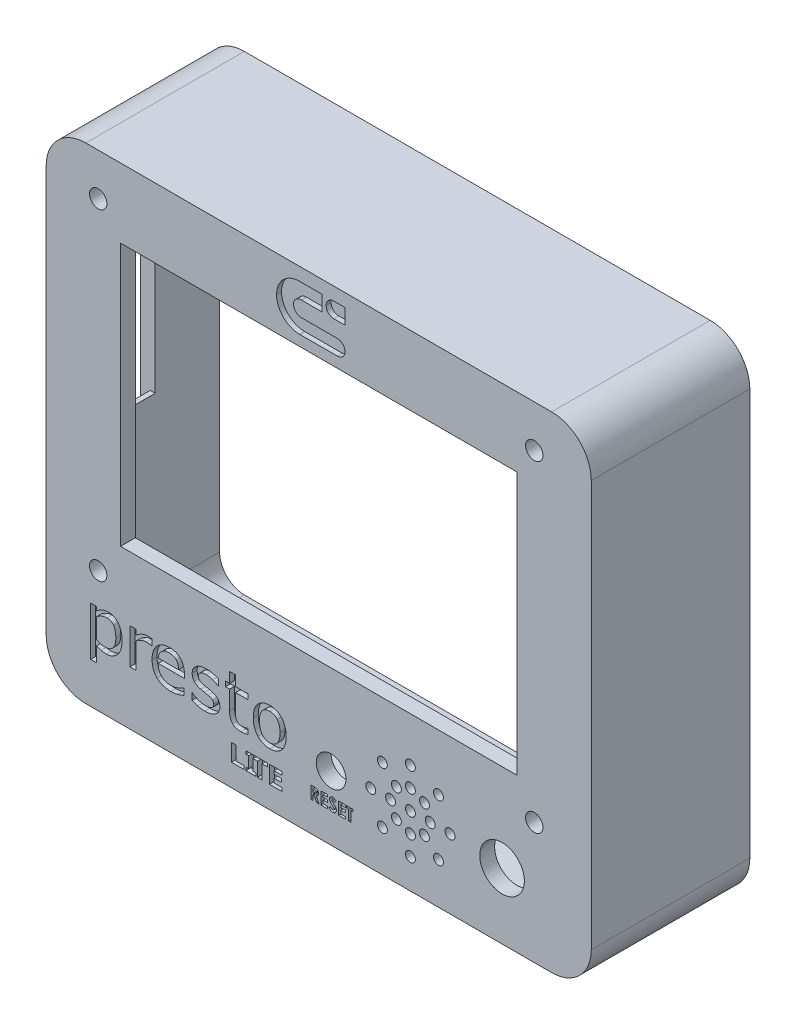
from build123d import *

# Parameters (mm, degrees)
ESBO_O1_W                = 110
ESBO_O1_H                = 98
RESSALTO_EXTRUS_O1_DEPTH = 22
FILETE1_R                = 8
CASCA1_T                 = -3
ESBO_O2_R                = 4.5
ESBO_O2_R_2              = 3
ESBO_O2_R_3              = 1.75
ESBO_O2_W                = 80
ESBO_O2_H                = 53
CORTE_EXTRUS_O1_DEPTH    = 77.876524375
ESBO_O3_R                = 1
CORTE_EXTRUS_O2_DEPTH    = 10
ESBO_O5_W                = 6
ESBO_O5_H                = 30
CORTE_EXTRUS_O3_DEPTH    = 4
CHANFRO1_SIZE            = 2
CORTE_EXTRUS_O4_DEPTH    = 1
CORTE_EXTRUS_O5_DEPTH    = 1
CORTE_EXTRUS_O6_DEPTH    = 1
RESSALTO_EXTRUS_O2_DEPTH = 10


with BuildPart() as part:
    # Esboço1 → Ressalto-extrusão1 (new body)
    with BuildSketch(Plane.XY):
        Rectangle(ESBO_O1_W, ESBO_O1_H)
    extrude(amount=RESSALTO_EXTRUS_O1_DEPTH)

    # Filete1
    filete1_edges = [part.edges().sort_by_distance(p)[0] for p in [
        (55, 49, 11),
        (55, -49, 11),
        (-55, -49, 11),
        (-55, 49, 11),
    ]]
    fillet(filete1_edges, radius=FILETE1_R)

    # Casca1
    casca1_openings = [part.faces().sort_by_distance(p)[0] for p in [
        (0, 0, 0),
    ]]
    offset(amount=CASCA1_T, openings=casca1_openings, kind=Kind.INTERSECTION)

    # Esboço2 → Corte-extrusão1 (cut, through all)
    with BuildSketch(Plane.XY.offset(22)):
        with Locations((37, -35.75)):
            Circle(ESBO_O2_R)
        with Locations((2.5, -36)):
            Circle(ESBO_O2_R_2)
        with Locations((-44.5, 40.5)):
            Circle(ESBO_O2_R_3)
        with Locations((43.5, 40.5)):
            Circle(ESBO_O2_R_3)
        with Locations((43.5, -24.5)):
            Circle(ESBO_O2_R_3)
        with Locations((-44.5, -24.5)):
            Circle(ESBO_O2_R_3)
        with Locations((0, 8.5)):
            Rectangle(ESBO_O2_W, ESBO_O2_H)
    extrude(amount=-CORTE_EXTRUS_O1_DEPTH, mode=Mode.SUBTRACT)

    # Esboço3 → Corte-extrusão2 (cut)
    with BuildSketch(Plane.XY.offset(22)):
        with Locations((18.5, -35)):
            Circle(ESBO_O3_R)
        with Locations((18.5, -27)):
            Circle(ESBO_O3_R)
        with Locations((26.5, -35)):
            Circle(ESBO_O3_R)
        with Locations((18.5, -43)):
            Circle(ESBO_O3_R)
        with Locations((10.5, -35)):
            Circle(ESBO_O3_R)
        with Locations((12.843145751, -29.343145751)):
            Circle(ESBO_O3_R)
        with Locations((24.156854249, -29.343145751)):
            Circle(ESBO_O3_R)
        with Locations((24.156854249, -40.656854249)):
            Circle(ESBO_O3_R)
        with Locations((12.843145751, -40.656854249)):
            Circle(ESBO_O3_R)
        with Locations((18.5, -31)):
            Circle(ESBO_O3_R)
        with Locations((21.328427125, -32.171572875)):
            Circle(ESBO_O3_R)
        with Locations((22.5, -35)):
            Circle(ESBO_O3_R)
        with Locations((21.328427125, -37.828427125)):
            Circle(ESBO_O3_R)
        with Locations((18.5, -39)):
            Circle(ESBO_O3_R)
        with Locations((15.671572875, -37.828427125)):
            Circle(ESBO_O3_R)
        with Locations((14.5, -35)):
            Circle(ESBO_O3_R)
        with Locations((15.671572875, -32.171572875)):
            Circle(ESBO_O3_R)
    extrude(amount=-CORTE_EXTRUS_O2_DEPTH, mode=Mode.SUBTRACT)

    # Esboço5 → Corte-extrusão3 (cut)
    with BuildSketch(Plane.ZY.offset(55)):
        with Locations((6, 8.25)):
            Rectangle(ESBO_O5_W, ESBO_O5_H)
    extrude(amount=-CORTE_EXTRUS_O3_DEPTH, mode=Mode.SUBTRACT)

    # Chanfro1
    chanfro1_edges = [part.edges().sort_by_distance(p)[0] for p in [
        (-55, 8.25, 9),
        (-55, 23.25, 6),
        (-55, -6.75, 6),
    ]]
    chamfer(chanfro1_edges, length=CHANFRO1_SIZE)

    # Esboço6 → Corte-extrusão4 (cut)
    with BuildSketch(Plane.XY.offset(22)):
        with BuildLine():
            Line((3.769042455, 40.21678814), (0.490728105, 40.21678814))
            Line((0.490728105, 40.21678814), (-3.553968015, 40.21678814))
            Line((-3.553968015, 40.21678814), (-3.553968015, 40.22878964))
            add(Edge.make_bspline(
                [(-3.553968015, 40.22878964), (-4.400740395, 40.2331712), (-5.085969075, 40.92059039), (-5.085969075, 41.76850595)],
                knots=[0, 0, 0, 0, 1, 1, 1, 1], degree=3))
            add(Edge.make_bspline(
                [(-5.085969075, 41.76850595), (-5.085969075, 42.6190883), (-4.396454145, 43.30869854), (-3.545776485, 43.30869854)],
                knots=[0, 0, 0, 0, 1, 1, 1, 1], degree=3))
            add(Edge.make_bspline(
                [(-3.545776485, 43.30869854), (-3.506723955, 43.30869854), (-3.468433635, 43.30565051), (-3.430047735, 43.30279283)],
                knots=[0, 0, 0, 0, 1, 1, 1, 1], degree=3))
            Line((-3.430047735, 43.30279283), (0.489775545, 43.30279283))
            Line((0.489775545, 43.30279283), (0.627030855, 43.30279283))
            Line((0.627030855, 43.30279283), (0.627030855, 46.38908345))
            Line((0.627030855, 46.38908345), (-3.570827355, 46.38908345))
            Line((-3.570827355, 46.38908345), (-3.570827355, 46.37803451))
            add(Edge.make_bspline(
                [(-3.570827355, 46.37803451), (-3.671792235, 46.38460658), (-3.773424015, 46.38908345), (-3.876103395, 46.38908345)],
                knots=[0, 0, 0, 0, 1, 1, 1, 1], degree=3))
            add(Edge.make_bspline(
                [(-3.876103395, 46.38908345), (-6.433470765, 46.38908345), (-8.506586925, 44.31577667), (-8.506586925, 41.75850461)],
                knots=[0, 0, 0, 0, 1, 1, 1, 1], degree=3))
            add(Edge.make_bspline(
                [(-8.506586925, 41.75850461), (-8.506586925, 39.2010422), (-6.433470765, 37.12792604), (-3.876103395, 37.12792604)],
                knots=[0, 0, 0, 0, 1, 1, 1, 1], degree=3))
            add(Edge.make_bspline(
                [(-3.876103395, 37.12792604), (-3.840194205, 37.12792604), (-3.804761295, 37.12983089), (-3.769042455, 37.13059283)],
                knots=[0, 0, 0, 0, 1, 1, 1, 1], degree=3))
            Line((-3.769042455, 37.13059283), (3.769042455, 37.13059283))
            add(Edge.make_bspline(
                [(3.769042455, 37.13059283), (4.621339575, 37.13059283), (5.312187765, 37.82144129), (5.312187765, 38.67383345)],
                knots=[0, 0, 0, 0, 1, 1, 1, 1], degree=3))
            add(Edge.make_bspline(
                [(5.312187765, 38.67383345), (5.312187765, 39.52593995), (4.621339575, 40.21678814), (3.769042455, 40.21678814)],
                knots=[0, 0, 0, 0, 1, 1, 1, 1], degree=3))
        make_face()
        with BuildLine():
            Line((3.032369595, 43.3028309), (5.284651005, 43.3028309))
            Line((5.284651005, 43.3028309), (5.284651005, 46.38912152))
            Line((5.284651005, 46.38912152), (3.032369595, 46.38912152))
            add(Edge.make_bspline(
                [(3.032369595, 46.38912152), (2.180167785, 46.38912152), (1.489319595, 45.69808271), (1.489319595, 44.84597621)],
                knots=[0, 0, 0, 0, 1, 1, 1, 1], degree=3))
            add(Edge.make_bspline(
                [(1.489319595, 44.84597621), (1.489319595, 43.99367936), (2.180167785, 43.3028309), (3.032369595, 43.3028309)],
                knots=[0, 0, 0, 0, 1, 1, 1, 1], degree=3))
        make_face()
    extrude(amount=-CORTE_EXTRUS_O4_DEPTH, mode=Mode.SUBTRACT)

    # Esboço7 → Corte-extrusão5 (cut)
    # profile 1 of 9: a face of its own
    with BuildSketch(Plane.XY.offset(22)):
        with BuildLine():
            Line((-44.812726377, -37.755554289), (-44.812726377, -40.769705489))
            Line((-44.812726377, -40.769705489), (-46.023538777, -40.769705489))
            Line((-46.023538777, -40.769705489), (-46.023538777, -30.922188689))
            Line((-46.023538777, -30.922188689), (-44.812726377, -30.922188689))
            Line((-44.812726377, -30.922188689), (-44.812726377, -31.675726689))
            add(Edge.make_bspline(
                [(-44.812726377, -31.675726689), (-44.490701177, -31.405225489), (-44.130033177, -31.179807889), (-43.730722377, -30.999474689)],
                knots=[0, 0, 0, 0, 1, 1, 1, 1], degree=3))
            add(Edge.make_bspline(
                [(-43.730722377, -30.999474689), (-43.327118377, -30.814847489), (-42.897752377, -30.722533489), (-42.442623977, -30.722533489)],
                knots=[0, 0, 0, 0, 1, 1, 1, 1], degree=3))
            add(Edge.make_bspline(
                [(-42.442623977, -30.722533489), (-41.575303977, -30.722533489), (-40.901198777, -31.050998289), (-40.420307577, -31.707928289)],
                knots=[0, 0, 0, 0, 1, 1, 1, 1], degree=3))
            add(Edge.make_bspline(
                [(-40.420307577, -31.707928289), (-39.935123977, -32.360565089), (-39.692532377, -33.268675489), (-39.692532377, -34.432258689)],
                knots=[0, 0, 0, 0, 1, 1, 1, 1], degree=3))
            add(Edge.make_bspline(
                [(-39.692532377, -34.432258689), (-39.692532377, -35.016197089), (-39.776258377, -35.550757889), (-39.943711177, -36.035941489)],
                knots=[0, 0, 0, 0, 1, 1, 1, 1], degree=3))
            add(Edge.make_bspline(
                [(-39.943711177, -36.035941489), (-40.111164377, -36.516831489), (-40.347315977, -36.924729489), (-40.652165577, -37.259635489)],
                knots=[0, 0, 0, 0, 1, 1, 1, 1], degree=3))
            add(Edge.make_bspline(
                [(-40.652165577, -37.259635489), (-40.935547577, -37.577366689), (-41.270453577, -37.824252289), (-41.656883577, -38.000292689)],
                knots=[0, 0, 0, 0, 1, 1, 1, 1], degree=3))
            add(Edge.make_bspline(
                [(-41.656883577, -38.000292689), (-42.039019177, -38.172039889), (-42.444770377, -38.257913089), (-42.874137577, -38.257913089)],
                knots=[0, 0, 0, 0, 1, 1, 1, 1], degree=3))
            add(Edge.make_bspline(
                [(-42.874137577, -38.257913089), (-43.247685977, -38.257913089), (-43.586885177, -38.217123089), (-43.891734777, -38.135542689)],
                knots=[0, 0, 0, 0, 1, 1, 1, 1], degree=3))
            add(Edge.make_bspline(
                [(-43.891734777, -38.135542689), (-44.192291577, -38.053963089), (-44.499288777, -37.927300289), (-44.812726377, -37.755554289)],
                knots=[0, 0, 0, 0, 1, 1, 1, 1], degree=3))
        make_face()
        with BuildLine():
            Line((-44.812726377, -32.693323889), (-44.812726377, -36.770158289))
            add(Edge.make_bspline(
                [(-44.812726377, -36.770158289), (-44.469233177, -36.924730289), (-44.175117177, -37.029925089), (-43.930377577, -37.085742689)],
                knots=[0, 0, 0, 0, 1, 1, 1, 1], degree=3))
            add(Edge.make_bspline(
                [(-43.930377577, -37.085742689), (-43.681345577, -37.141560289), (-43.400110777, -37.169469089), (-43.086673177, -37.169469089)],
                knots=[0, 0, 0, 0, 1, 1, 1, 1], degree=3))
            add(Edge.make_bspline(
                [(-43.086673177, -37.169469089), (-42.412567977, -37.169469089), (-41.886593977, -36.941905089), (-41.508751977, -36.486776689)],
                knots=[0, 0, 0, 0, 1, 1, 1, 1], degree=3))
            add(Edge.make_bspline(
                [(-41.508751977, -36.486776689), (-41.130909977, -36.031647889), (-40.941988777, -35.357542689), (-40.941988777, -34.464460289)],
                knots=[0, 0, 0, 0, 1, 1, 1, 1], degree=3))
            add(Edge.make_bspline(
                [(-40.941988777, -34.464460289), (-40.941988777, -33.597140289), (-41.090119977, -32.948797089), (-41.386382777, -32.519431089)],
                knots=[0, 0, 0, 0, 1, 1, 1, 1], degree=3))
            add(Edge.make_bspline(
                [(-41.386382777, -32.519431089), (-41.682645177, -32.090065089), (-42.137773177, -31.875381889), (-42.751766777, -31.875381889)],
                knots=[0, 0, 0, 0, 1, 1, 1, 1], degree=3))
            add(Edge.make_bspline(
                [(-42.751766777, -31.875381889), (-43.099554377, -31.875381889), (-43.449487977, -31.950520689), (-43.801567977, -32.100798689)],
                knots=[0, 0, 0, 0, 1, 1, 1, 1], degree=3))
            add(Edge.make_bspline(
                [(-43.801567977, -32.100798689), (-44.153648377, -32.251077089), (-44.490701177, -32.448585489), (-44.812726377, -32.693323889)],
                knots=[0, 0, 0, 0, 1, 1, 1, 1], degree=3))
        make_face(mode=Mode.SUBTRACT)
    # profile 2 of 9: a face of its own
    with BuildSketch(Plane.XY.offset(22)):
        with BuildLine():
            Line((-33.613767971, -32.242489889), (-33.678172371, -32.242489889))
            add(Edge.make_bspline(
                [(-33.678172371, -32.242489889), (-33.858506371, -32.199553089), (-34.034546771, -32.169497489), (-34.206293571, -32.152323089)],
                knots=[0, 0, 0, 0, 1, 1, 1, 1], degree=3))
            add(Edge.make_bspline(
                [(-34.206293571, -32.152323089), (-34.373746371, -32.130854689), (-34.573401571, -32.120120689), (-34.805259571, -32.120120689)],
                knots=[0, 0, 0, 0, 1, 1, 1, 1], degree=3))
            add(Edge.make_bspline(
                [(-34.805259571, -32.120120689), (-35.178808371, -32.120120689), (-35.539475571, -32.203847089), (-35.887262371, -32.371299489)],
                knots=[0, 0, 0, 0, 1, 1, 1, 1], degree=3))
            add(Edge.make_bspline(
                [(-35.887262371, -32.371299489), (-36.235048771, -32.534459489), (-36.569954771, -32.746995489), (-36.891980371, -33.008908289)],
                knots=[0, 0, 0, 0, 1, 1, 1, 1], degree=3))
            Line((-36.891980371, -33.008908289), (-36.891980371, -38.116221889))
            Line((-36.891980371, -38.116221889), (-38.102792771, -38.116221889))
            Line((-38.102792771, -38.116221889), (-38.102792771, -30.922188689))
            Line((-38.102792771, -30.922188689), (-36.891980371, -30.922188689))
            Line((-36.891980371, -30.922188689), (-36.891980371, -31.984870689))
            add(Edge.make_bspline(
                [(-36.891980371, -31.984870689), (-36.411089171, -31.598440689), (-35.988163171, -31.325793089), (-35.623201571, -31.166927489)],
                knots=[0, 0, 0, 0, 1, 1, 1, 1], degree=3))
            add(Edge.make_bspline(
                [(-35.623201571, -31.166927489), (-35.253946771, -31.003768289), (-34.878251171, -30.922188689), (-34.496115571, -30.922188689)],
                knots=[0, 0, 0, 0, 1, 1, 1, 1], degree=3))
            add(Edge.make_bspline(
                [(-34.496115571, -30.922188689), (-34.285725971, -30.922188689), (-34.133300771, -30.928629089), (-34.038839971, -30.941509889)],
                knots=[0, 0, 0, 0, 1, 1, 1, 1], degree=3))
            add(Edge.make_bspline(
                [(-34.038839971, -30.941509889), (-33.944379971, -30.950096689), (-33.802689171, -30.969418689), (-33.613767971, -30.999474689)],
                knots=[0, 0, 0, 0, 1, 1, 1, 1], degree=3))
            Line((-33.613767971, -30.999474689), (-33.613767971, -32.242489889))
        make_face()
    # profile 3 of 9: a face of its own
    with BuildSketch(Plane.XY.offset(22)):
        with BuildLine():
            Line((-27.095060371, -34.644794689), (-32.395587571, -34.644794689))
            add(Edge.make_bspline(
                [(-32.395587571, -34.644794689), (-32.395587571, -35.087042289), (-32.329035971, -35.473471889), (-32.195932371, -35.804083489)],
                knots=[0, 0, 0, 0, 1, 1, 1, 1], degree=3))
            add(Edge.make_bspline(
                [(-32.195932371, -35.804083489), (-32.062828771, -36.130402289), (-31.880347971, -36.398756689), (-31.648489971, -36.609146289)],
                knots=[0, 0, 0, 0, 1, 1, 1, 1], degree=3))
            add(Edge.make_bspline(
                [(-31.648489971, -36.609146289), (-31.425219971, -36.815242289), (-31.161159571, -36.969813889), (-30.856309171, -37.072861089)],
                knots=[0, 0, 0, 0, 1, 1, 1, 1], degree=3))
            add(Edge.make_bspline(
                [(-30.856309171, -37.072861089), (-30.547165171, -37.175909089), (-30.207965571, -37.227433089), (-29.838710771, -37.227433089)],
                knots=[0, 0, 0, 0, 1, 1, 1, 1], degree=3))
            add(Edge.make_bspline(
                [(-29.838710771, -37.227433089), (-29.349233571, -37.227433089), (-28.857609171, -37.130825489), (-28.363837571, -36.937611089)],
                knots=[0, 0, 0, 0, 1, 1, 1, 1], degree=3))
            add(Edge.make_bspline(
                [(-28.363837571, -36.937611089), (-27.865772771, -36.740102689), (-27.511545171, -36.546887889), (-27.301155971, -36.357966289)],
                knots=[0, 0, 0, 0, 1, 1, 1, 1], degree=3))
            Line((-27.301155971, -36.357966289), (-27.236750371, -36.357966289))
            Line((-27.236750371, -36.357966289), (-27.236750371, -37.678268289))
            add(Edge.make_bspline(
                [(-27.236750371, -37.678268289), (-27.644648771, -37.850014289), (-28.061134371, -37.993852289), (-28.486206771, -38.109781489)],
                knots=[0, 0, 0, 0, 1, 1, 1, 1], degree=3))
            add(Edge.make_bspline(
                [(-28.486206771, -38.109781489), (-28.911279571, -38.225710289), (-29.357820371, -38.283674289), (-29.825829971, -38.283674289)],
                knots=[0, 0, 0, 0, 1, 1, 1, 1], degree=3))
            add(Edge.make_bspline(
                [(-29.825829971, -38.283674289), (-31.019468371, -38.283674289), (-31.951193171, -37.961649889), (-32.621005171, -37.317600689)],
                knots=[0, 0, 0, 0, 1, 1, 1, 1], degree=3))
            add(Edge.make_bspline(
                [(-32.621005171, -37.317600689), (-33.290816371, -36.669257089), (-33.625721971, -35.750413089), (-33.625721971, -34.561068689)],
                knots=[0, 0, 0, 0, 1, 1, 1, 1], degree=3))
            add(Edge.make_bspline(
                [(-33.625721971, -34.561068689), (-33.625721971, -33.384604289), (-33.305843971, -32.450732689), (-32.666088371, -31.759453089)],
                knots=[0, 0, 0, 0, 1, 1, 1, 1], degree=3))
            add(Edge.make_bspline(
                [(-32.666088371, -31.759453089), (-32.022039171, -31.068173489), (-31.176187571, -30.722533489), (-30.128533571, -30.722533489)],
                knots=[0, 0, 0, 0, 1, 1, 1, 1], degree=3))
            add(Edge.make_bspline(
                [(-30.128533571, -30.722533489), (-29.158165571, -30.722533489), (-28.411067971, -31.005915089), (-27.887241171, -31.572678289)],
                knots=[0, 0, 0, 0, 1, 1, 1, 1], degree=3))
            add(Edge.make_bspline(
                [(-27.887241171, -31.572678289), (-27.359120371, -32.139442289), (-27.095060371, -32.944504289), (-27.095060371, -33.987863889)],
                knots=[0, 0, 0, 0, 1, 1, 1, 1], degree=3))
            Line((-27.095060371, -33.987863889), (-27.095060371, -34.644794689))
        make_face()
        with BuildLine():
            Line((-32.395587571, -33.717363089), (-28.273671171, -33.717363089))
            add(Edge.make_bspline(
                [(-28.273671171, -33.717363089), (-28.277968371, -33.081900689), (-28.438980771, -32.590276289), (-28.756707971, -32.242489889)],
                knots=[0, 0, 0, 0, 1, 1, 1, 1], degree=3))
            add(Edge.make_bspline(
                [(-28.756707971, -32.242489889), (-29.070145571, -31.894703489), (-29.548888771, -31.720809889), (-30.192937971, -31.720809889)],
                knots=[0, 0, 0, 0, 1, 1, 1, 1], degree=3))
            add(Edge.make_bspline(
                [(-30.192937971, -31.720809889), (-30.841281571, -31.720809889), (-31.358667971, -31.911877889), (-31.745097971, -32.294013489)],
                knots=[0, 0, 0, 0, 1, 1, 1, 1], degree=3))
            add(Edge.make_bspline(
                [(-31.745097971, -32.294013489), (-32.127233571, -32.676149889), (-32.344063571, -33.150599889), (-32.395587571, -33.717363089)],
                knots=[0, 0, 0, 0, 1, 1, 1, 1], degree=3))
        make_face(mode=Mode.SUBTRACT)
    # profile 4 of 9: a face of its own
    with BuildSketch(Plane.XY.offset(22)):
        with BuildLine():
            Line((-25.567168771, -37.684708689), (-25.567168771, -36.325764689))
            Line((-25.567168771, -36.325764689), (-25.502764771, -36.325764689))
            add(Edge.make_bspline(
                [(-25.502764771, -36.325764689), (-25.120628371, -36.613439489), (-24.695555171, -36.843150289), (-24.227545971, -37.014897089)],
                knots=[0, 0, 0, 0, 1, 1, 1, 1], degree=3))
            add(Edge.make_bspline(
                [(-24.227545971, -37.014897089), (-23.759536371, -37.182349489), (-23.310848771, -37.266075889), (-22.881482371, -37.266075889)],
                knots=[0, 0, 0, 0, 1, 1, 1, 1], degree=3))
            add(Edge.make_bspline(
                [(-22.881482371, -37.266075889), (-22.349068371, -37.266075889), (-21.932582771, -37.180202689), (-21.632025971, -37.008456689)],
                knots=[0, 0, 0, 0, 1, 1, 1, 1], degree=3))
            add(Edge.make_bspline(
                [(-21.632025971, -37.008456689), (-21.331469971, -36.836709889), (-21.181191971, -36.566208689), (-21.181191971, -36.196953889)],
                knots=[0, 0, 0, 0, 1, 1, 1, 1], degree=3))
            add(Edge.make_bspline(
                [(-21.181191971, -36.196953889), (-21.181191971, -35.913572689), (-21.262771171, -35.698889489), (-21.425930371, -35.552904689)],
                knots=[0, 0, 0, 0, 1, 1, 1, 1], degree=3))
            add(Edge.make_bspline(
                [(-21.425930371, -35.552904689), (-21.589089571, -35.406919889), (-21.902526771, -35.282403089), (-22.366242771, -35.179355489)],
                knots=[0, 0, 0, 0, 1, 1, 1, 1], degree=3))
            add(Edge.make_bspline(
                [(-22.366242771, -35.179355489), (-22.537989971, -35.140712689), (-22.763407171, -35.095629489), (-23.042494771, -35.044105489)],
                knots=[0, 0, 0, 0, 1, 1, 1, 1], degree=3))
            add(Edge.make_bspline(
                [(-23.042494771, -35.044105489), (-23.317289571, -34.992581489), (-23.568468771, -34.936763889), (-23.796032771, -34.876652689)],
                knots=[0, 0, 0, 0, 1, 1, 1, 1], degree=3))
            add(Edge.make_bspline(
                [(-23.796032771, -34.876652689), (-24.427201171, -34.709199489), (-24.875888771, -34.464460289), (-25.142095971, -34.142435889)],
                knots=[0, 0, 0, 0, 1, 1, 1, 1], degree=3))
            add(Edge.make_bspline(
                [(-25.142095971, -34.142435889), (-25.404009571, -33.816117889), (-25.534966371, -33.416807089), (-25.534966371, -32.944504289)],
                knots=[0, 0, 0, 0, 1, 1, 1, 1], degree=3))
            add(Edge.make_bspline(
                [(-25.534966371, -32.944504289), (-25.534966371, -32.648241489), (-25.474855171, -32.369153489), (-25.354633171, -32.107239889)],
                knots=[0, 0, 0, 0, 1, 1, 1, 1], degree=3))
            add(Edge.make_bspline(
                [(-25.354633171, -32.107239889), (-25.230116771, -31.845326289), (-25.043342371, -31.611321889), (-24.794310371, -31.405225889)],
                knots=[0, 0, 0, 0, 1, 1, 1, 1], degree=3))
            add(Edge.make_bspline(
                [(-24.794310371, -31.405225889), (-24.553864371, -31.203423489), (-24.249013971, -31.044557889), (-23.879758771, -30.928629089)],
                knots=[0, 0, 0, 0, 1, 1, 1, 1], degree=3))
            add(Edge.make_bspline(
                [(-23.879758771, -30.928629089), (-23.506210371, -30.808406289), (-23.089725171, -30.748294689), (-22.630303571, -30.748294689)],
                knots=[0, 0, 0, 0, 1, 1, 1, 1], degree=3))
            add(Edge.make_bspline(
                [(-22.630303571, -30.748294689), (-22.200936771, -30.748294689), (-21.767276771, -30.801965489), (-21.329323571, -30.909307089)],
                knots=[0, 0, 0, 0, 1, 1, 1, 1], degree=3))
            add(Edge.make_bspline(
                [(-21.329323571, -30.909307089), (-20.887075971, -31.012355089), (-20.519967571, -31.139018289), (-20.227998771, -31.289296689)],
                knots=[0, 0, 0, 0, 1, 1, 1, 1], degree=3))
            Line((-20.227998771, -31.289296689), (-20.227998771, -32.583836689))
            Line((-20.227998771, -32.583836689), (-20.292402771, -32.583836689))
            add(Edge.make_bspline(
                [(-20.292402771, -32.583836689), (-20.601546771, -32.356272289), (-20.977242771, -32.165203889), (-21.419489971, -32.010631889)],
                knots=[0, 0, 0, 0, 1, 1, 1, 1], degree=3))
            add(Edge.make_bspline(
                [(-21.419489971, -32.010631889), (-21.861737571, -31.851766289), (-22.295397571, -31.772333489), (-22.720469971, -31.772333489)],
                knots=[0, 0, 0, 0, 1, 1, 1, 1], degree=3))
            add(Edge.make_bspline(
                [(-22.720469971, -31.772333489), (-23.162717571, -31.772333489), (-23.536266371, -31.858207089), (-23.841115971, -32.029953889)],
                knots=[0, 0, 0, 0, 1, 1, 1, 1], degree=3))
            add(Edge.make_bspline(
                [(-23.841115971, -32.029953889), (-24.145966371, -32.197406689), (-24.298391571, -32.448585889), (-24.298391571, -32.783491889)],
                knots=[0, 0, 0, 0, 1, 1, 1, 1], degree=3))
            add(Edge.make_bspline(
                [(-24.298391571, -32.783491889), (-24.298391571, -33.079754289), (-24.206077971, -33.303025089), (-24.021450371, -33.453303489)],
                knots=[0, 0, 0, 0, 1, 1, 1, 1], degree=3))
            add(Edge.make_bspline(
                [(-24.021450371, -33.453303489), (-23.841116371, -33.603581089), (-23.549147171, -33.725950289), (-23.145543171, -33.820411089)],
                knots=[0, 0, 0, 0, 1, 1, 1, 1], degree=3))
            add(Edge.make_bspline(
                [(-23.145543171, -33.820411089), (-22.922272371, -33.871935089), (-22.673239571, -33.923459089), (-22.398445571, -33.974983089)],
                knots=[0, 0, 0, 0, 1, 1, 1, 1], degree=3))
            add(Edge.make_bspline(
                [(-22.398445571, -33.974983089), (-22.119357171, -34.026507089), (-21.887499171, -34.073737889), (-21.702871571, -34.116674689)],
                knots=[0, 0, 0, 0, 1, 1, 1, 1], degree=3))
            add(Edge.make_bspline(
                [(-21.702871571, -34.116674689), (-21.140401971, -34.245483889), (-20.706741971, -34.466607089), (-20.401891571, -34.780044689)],
                knots=[0, 0, 0, 0, 1, 1, 1, 1], degree=3))
            add(Edge.make_bspline(
                [(-20.401891571, -34.780044689), (-20.097041971, -35.097775889), (-19.944617171, -35.518554689), (-19.944617171, -36.042381889)],
                knots=[0, 0, 0, 0, 1, 1, 1, 1], degree=3))
            add(Edge.make_bspline(
                [(-19.944617171, -36.042381889), (-19.944617171, -36.699312289), (-20.217264371, -37.238167089), (-20.762559171, -37.658946289)],
                knots=[0, 0, 0, 0, 1, 1, 1, 1], degree=3))
            add(Edge.make_bspline(
                [(-20.762559171, -37.658946289), (-21.303561171, -38.079725089), (-22.044218371, -38.290114689), (-22.984530771, -38.290114689)],
                knots=[0, 0, 0, 0, 1, 1, 1, 1], degree=3))
            add(Edge.make_bspline(
                [(-22.984530771, -38.290114689), (-23.516944771, -38.290114689), (-24.006422371, -38.227857089), (-24.452963571, -38.103341089)],
                knots=[0, 0, 0, 0, 1, 1, 1, 1], degree=3))
            add(Edge.make_bspline(
                [(-24.452963571, -38.103341089), (-24.895211171, -37.974531089), (-25.266612771, -37.834987089), (-25.567168771, -37.684708689)],
                knots=[0, 0, 0, 0, 1, 1, 1, 1], degree=3))
        make_face()
    # profile 5 of 9: a face of its own
    with BuildSketch(Plane.XY.offset(22)):
        with BuildLine():
            Line((-17.988455971, -35.765440689), (-17.988455971, -31.939786289))
            Line((-17.988455971, -31.939786289), (-18.806397971, -31.939786289))
            Line((-18.806397971, -31.939786289), (-18.806397971, -30.922188689))
            Line((-18.806397971, -30.922188689), (-17.988455971, -30.922188689))
            Line((-17.988455971, -30.922188689), (-17.988455971, -28.854789089))
            Line((-17.988455971, -28.854789089), (-16.777642371, -28.854789089))
            Line((-16.777642371, -28.854789089), (-16.777642371, -30.922188689))
            Line((-16.777642371, -30.922188689), (-14.278729171, -30.922188689))
            Line((-14.278729171, -30.922188689), (-14.278729171, -31.939786289))
            Line((-14.278729171, -31.939786289), (-16.777642371, -31.939786289))
            Line((-16.777642371, -31.939786289), (-16.777642371, -35.217998289))
            add(Edge.make_bspline(
                [(-16.777642371, -35.217998289), (-16.777642371, -35.595841089), (-16.769054771, -35.892104289), (-16.751879971, -36.106787089)],
                knots=[0, 0, 0, 0, 1, 1, 1, 1], degree=3))
            add(Edge.make_bspline(
                [(-16.751879971, -36.106787089), (-16.734705971, -36.317176689), (-16.674594771, -36.514685089), (-16.571546771, -36.699312689)],
                knots=[0, 0, 0, 0, 1, 1, 1, 1], degree=3))
            add(Edge.make_bspline(
                [(-16.571546771, -36.699312689), (-16.477085971, -36.871059489), (-16.348275971, -36.997722689), (-16.185116771, -37.079302289)],
                knots=[0, 0, 0, 0, 1, 1, 1, 1], degree=3))
            add(Edge.make_bspline(
                [(-16.185116771, -37.079302289), (-16.017663571, -37.156588289), (-15.764337171, -37.195231489), (-15.425138771, -37.195231489)],
                knots=[0, 0, 0, 0, 1, 1, 1, 1], degree=3))
            add(Edge.make_bspline(
                [(-15.425138771, -37.195231489), (-15.227629571, -37.195231489), (-15.021533571, -37.167322289), (-14.806850771, -37.111503889)],
                knots=[0, 0, 0, 0, 1, 1, 1, 1], degree=3))
            add(Edge.make_bspline(
                [(-14.806850771, -37.111503889), (-14.592167571, -37.051392689), (-14.437595571, -37.002015889), (-14.343134771, -36.963373489)],
                knots=[0, 0, 0, 0, 1, 1, 1, 1], degree=3))
            Line((-14.343134771, -36.963373489), (-14.278729171, -36.963373489))
            Line((-14.278729171, -36.963373489), (-14.278729171, -38.051816289))
            add(Edge.make_bspline(
                [(-14.278729171, -38.051816289), (-14.506293971, -38.111928289), (-14.755326371, -38.161305489), (-15.025826771, -38.199948289)],
                knots=[0, 0, 0, 0, 1, 1, 1, 1], degree=3))
            add(Edge.make_bspline(
                [(-15.025826771, -38.199948289), (-15.292034771, -38.238591489), (-15.530333571, -38.257913089), (-15.740722771, -38.257913089)],
                knots=[0, 0, 0, 0, 1, 1, 1, 1], degree=3))
            add(Edge.make_bspline(
                [(-15.740722771, -38.257913089), (-16.474938771, -38.257913089), (-17.033114771, -38.060404689), (-17.415251171, -37.665387489)],
                knots=[0, 0, 0, 0, 1, 1, 1, 1], degree=3))
            add(Edge.make_bspline(
                [(-17.415251171, -37.665387489), (-17.797387571, -37.270369889), (-17.988455971, -36.637054289), (-17.988455971, -35.765440689)],
                knots=[0, 0, 0, 0, 1, 1, 1, 1], degree=3))
        make_face()
    # profile 6 of 9: a face of its own
    with BuildSketch(Plane.XY.offset(22)):
        Polygon((-15.116117571, -44.545596289), (-17.634863171, -44.545596289), (-17.634863171, -41.053593089), (-16.734306371, -41.053593089), (-16.734306371, -43.870178689), (-15.116117571, -43.870178689), align=None)
    # profile 7 of 9: a face of its own
    with BuildSketch(Plane.XY.offset(22)):
        Polygon((-12.663471171, -44.545596289), (-14.708485971, -44.545596289), (-14.708485971, -43.926463889), (-14.136256771, -43.926463889), (-14.136256771, -41.672726289), (-14.708485971, -41.672726289), (-14.708485971, -41.053593089), (-10.359098371, -41.053593089), (-10.359098371, -41.729010689), (-11.449617571, -41.729010689), (-11.449617571, -44.545596289), (-12.350173971, -44.545596289), (-12.350173971, -41.729010689), (-13.235700371, -41.729010689), (-13.235700371, -43.926463889), (-12.663471171, -43.926463889), align=None)
    # profile 8 of 9: a face of its own
    with BuildSketch(Plane.XY.offset(22)):
        Polygon((-7.390711171, -44.545596289), (-9.916491571, -44.545596289), (-9.916491571, -41.053593089), (-7.390711171, -41.053593089), (-7.390711171, -41.729010689), (-9.020625571, -41.729010689), (-9.020625571, -42.331727889), (-7.507971171, -42.331727889), (-7.507971171, -43.007145489), (-9.020625571, -43.007145489), (-9.020625571, -43.870178689), (-7.390711171, -43.870178689), align=None)
    # profile 9 of 9: a face of its own
    with BuildSketch(Plane.XY.offset(22)):
        with BuildLine():
            add(Edge.make_bspline(
                [(-6.567241971, -34.522425489), (-6.567241971, -35.694595089), (-6.867798371, -36.619879489), (-7.468911571, -37.298278689)],
                knots=[0, 0, 0, 0, 1, 1, 1, 1], degree=3))
            add(Edge.make_bspline(
                [(-7.468911571, -37.298278689), (-8.070024371, -37.976677489), (-8.875086371, -38.315877089), (-9.884097171, -38.315877089)],
                knots=[0, 0, 0, 0, 1, 1, 1, 1], degree=3))
            add(Edge.make_bspline(
                [(-9.884097171, -38.315877089), (-10.901695571, -38.315877089), (-11.711050771, -37.976677489), (-12.312163171, -37.298278689)],
                knots=[0, 0, 0, 0, 1, 1, 1, 1], degree=3))
            add(Edge.make_bspline(
                [(-12.312163171, -37.298278689), (-12.908982771, -36.619879489), (-13.207392371, -35.694595089), (-13.207392371, -34.522425489)],
                knots=[0, 0, 0, 0, 1, 1, 1, 1], degree=3))
            add(Edge.make_bspline(
                [(-13.207392371, -34.522425489), (-13.207392371, -33.350255089), (-12.908982771, -32.424970289), (-12.312163171, -31.746571089)],
                knots=[0, 0, 0, 0, 1, 1, 1, 1], degree=3))
            add(Edge.make_bspline(
                [(-12.312163171, -31.746571089), (-11.711050771, -31.063879489), (-10.901695571, -30.722533489), (-9.884097171, -30.722533489)],
                knots=[0, 0, 0, 0, 1, 1, 1, 1], degree=3))
            add(Edge.make_bspline(
                [(-9.884097171, -30.722533489), (-8.875086371, -30.722533489), (-8.070024371, -31.063879489), (-7.468911571, -31.746571089)],
                knots=[0, 0, 0, 0, 1, 1, 1, 1], degree=3))
            add(Edge.make_bspline(
                [(-7.468911571, -31.746571089), (-6.867798371, -32.424970289), (-6.567241971, -33.350255089), (-6.567241971, -34.522425489)],
                knots=[0, 0, 0, 0, 1, 1, 1, 1], degree=3))
        make_face()
        with BuildLine():
            add(Edge.make_bspline(
                [(-7.816698371, -34.522425489), (-7.816698371, -33.590699889), (-7.999178771, -32.899419889), (-8.364139571, -32.448585489)],
                knots=[0, 0, 0, 0, 1, 1, 1, 1], degree=3))
            add(Edge.make_bspline(
                [(-8.364139571, -32.448585489), (-8.729101171, -31.993457489), (-9.235753571, -31.765893489), (-9.884097171, -31.765893489)],
                knots=[0, 0, 0, 0, 1, 1, 1, 1], degree=3))
            add(Edge.make_bspline(
                [(-9.884097171, -31.765893489), (-10.541027571, -31.765893489), (-11.051973571, -31.993457489), (-11.416935171, -32.448585489)],
                knots=[0, 0, 0, 0, 1, 1, 1, 1], degree=3))
            add(Edge.make_bspline(
                [(-11.416935171, -32.448585489), (-11.777602371, -32.899419889), (-11.957935971, -33.590699889), (-11.957935971, -34.522425489)],
                knots=[0, 0, 0, 0, 1, 1, 1, 1], degree=3))
            add(Edge.make_bspline(
                [(-11.957935971, -34.522425489), (-11.957935971, -35.424094689), (-11.775455571, -36.108933889), (-11.410494771, -36.576943489)],
                knots=[0, 0, 0, 0, 1, 1, 1, 1], degree=3))
            add(Edge.make_bspline(
                [(-11.410494771, -36.576943489), (-11.045533171, -37.040659489), (-10.536733971, -37.272517489), (-9.884097171, -37.272517489)],
                knots=[0, 0, 0, 0, 1, 1, 1, 1], degree=3))
            add(Edge.make_bspline(
                [(-9.884097171, -37.272517489), (-9.240047171, -37.272517489), (-8.735541571, -37.042806289), (-8.370581171, -36.583383889)],
                knots=[0, 0, 0, 0, 1, 1, 1, 1], degree=3))
            add(Edge.make_bspline(
                [(-8.370581171, -36.583383889), (-8.001325971, -36.119667889), (-7.816698371, -35.432681889), (-7.816698371, -34.522425489)],
                knots=[0, 0, 0, 0, 1, 1, 1, 1], degree=3))
        make_face(mode=Mode.SUBTRACT)
    extrude(amount=-CORTE_EXTRUS_O5_DEPTH, mode=Mode.SUBTRACT)

    # Esboço8 → Corte-extrusão6 (cut)
    # profile 1 of 5: a face of its own
    with BuildSketch(Plane.XY.offset(22)):
        with BuildLine():
            Line((-1.579155024, -40.5), (-1.056318485, -40.5))
            add(Edge.make_bspline(
                [(-1.056318485, -40.5), (-1.021759149, -40.500122666), (-0.955291811, -40.500358587), (-0.85944954, -40.504080794), (-0.771405233, -40.50926055), (-0.691028534, -40.517164996), (-0.618353828, -40.527645336), (-0.553308279, -40.539999922), (-0.495893787, -40.554080622), (-0.445626141, -40.571626285), (-0.400262077, -40.591417526), (-0.357976462, -40.614158026), (-0.317836413, -40.639594561), (-0.280110222, -40.668396435), (-0.244470042, -40.70004551), (-0.210848633, -40.734573644), (-0.179721098, -40.77227362), (-0.15128018, -40.812907224), (-0.125358573, -40.855652843), (-0.102449308, -40.900569167), (-0.083819457, -40.947687434), (-0.067357985, -40.996326682), (-0.055501321, -41.047182218), (-0.047255184, -41.099758956), (-0.041217686, -41.154241971), (-0.040870558, -41.191255313), (-0.040693485, -41.210136218)],
                knots=[0, 0, 0, 0, 1.749336639, 3.364467119, 4.854658419, 6.213483162, 7.451590619, 8.570285859, 9.5643256, 10.440900261, 11.26203566, 12.067320669, 12.869050712, 13.665104639, 14.467235401, 15.27997916, 16.102287765, 16.939272006, 17.78853747, 18.631303466, 19.488103222, 20.351255419, 21.228522269, 22.127379805, 23.044756219, 24, 24, 24, 24], degree=3))
            add(Edge.make_bspline(
                [(-0.040693485, -41.210136218), (-0.041153458, -41.229843546), (-0.042055381, -41.268486023), (-0.04691363, -41.325248671), (-0.055792983, -41.379555202), (-0.069242055, -41.431246613), (-0.084700016, -41.480966265), (-0.105255139, -41.527796798), (-0.128453628, -41.572419296), (-0.156005794, -41.614202555), (-0.186242951, -41.654074665), (-0.221408128, -41.690507978), (-0.259223163, -41.725460647), (-0.301813775, -41.756743355), (-0.347302532, -41.786471325), (-0.396593246, -41.813412783), (-0.449364231, -41.838244975), (-0.486464846, -41.852093121), (-0.505437075, -41.859174679)],
                knots=[0, 0, 0, 0, 1.099860209, 2.156625411, 3.176576793, 4.16617041, 5.135385252, 6.078461593, 7.016046972, 7.938469504, 8.868247731, 9.803980173, 10.76021508, 11.73834243, 12.748633912, 13.790971185, 14.870363756, 16, 16, 16, 16], degree=3))
            Line((-0.505437075, -41.859174679), (0.071486002, -43))
            Line((0.071486002, -43), (-0.427312075, -43))
            Line((-0.427312075, -43), (-0.978193485, -41.91025641))
            Line((-0.978193485, -41.91025641), (-1.130437075, -41.91025641))
            Line((-1.130437075, -41.91025641), (-1.130437075, -43))
            Line((-1.130437075, -43), (-1.579155024, -43))
            Line((-1.579155024, -43), (-1.579155024, -40.5))
        make_face()
        with BuildLine():
            Line((-1.130437075, -41.461538462), (-0.955657427, -41.461538462))
            add(Edge.make_bspline(
                [(-0.955657427, -41.461538462), (-0.934289163, -41.461297798), (-0.893373527, -41.460836978), (-0.834531469, -41.458699507), (-0.781088848, -41.453549257), (-0.732816162, -41.447042109), (-0.689470507, -41.439528667), (-0.651438513, -41.428761449), (-0.618134163, -41.417224101), (-0.589952116, -41.402886171), (-0.565874023, -41.386580835), (-0.54508413, -41.368057568), (-0.527887908, -41.346619244), (-0.51373454, -41.322848466), (-0.502724759, -41.296534987), (-0.494688462, -41.267967668), (-0.49019736, -41.236821092), (-0.489680644, -41.215325713), (-0.489411434, -41.204126603)],
                knots=[0, 0, 0, 0, 1.688639943, 3.233382647, 4.650958383, 5.928841754, 7.082724185, 8.122798841, 9.049171256, 9.863274652, 10.613301712, 11.341792392, 12.054588806, 12.776240173, 13.521029143, 14.301969904, 15.115324896, 16, 16, 16, 16], degree=3))
            add(Edge.make_bspline(
                [(-0.489411434, -41.204126603), (-0.489920399, -41.190877237), (-0.490920168, -41.164851315), (-0.500840981, -41.127383112), (-0.516632771, -41.092703727), (-0.538278991, -41.06096985), (-0.56553959, -41.033149743), (-0.596823278, -41.008626096), (-0.632805234, -40.989234632), (-0.666121816, -40.976444228), (-0.696432119, -40.968791598), (-0.723786211, -40.963088925), (-0.755462414, -40.959047277), (-0.791484643, -40.954760391), (-0.831761074, -40.951980562), (-0.876511239, -40.94995184), (-0.925606616, -40.949121791), (-0.959830757, -40.948856439), (-0.977692684, -40.948717949)],
                knots=[0, 0, 0, 0, 1.020303359, 2.004196876, 2.966617323, 3.9489082, 4.950758222, 5.960522915, 7.003732012, 8.091992268, 8.70421221, 9.413913587, 10.24622431, 11.166358409, 12.212345909, 13.359657661, 14.621978493, 16, 16, 16, 16], degree=3))
            Line((-0.977692684, -40.948717949), (-1.130437075, -40.948717949))
            Line((-1.130437075, -40.948717949), (-1.130437075, -41.461538462))
        make_face(mode=Mode.SUBTRACT)
    # profile 2 of 5: a face of its own
    with BuildSketch(Plane.XY.offset(22)):
        Polygon((0.440075746, -40.5), (1.786229592, -40.5), (1.786229592, -40.948717949), (0.888793694, -40.948717949), (0.888793694, -41.429487179), (1.786229592, -41.429487179), (1.786229592, -41.878205128), (0.888793694, -41.878205128), (0.888793694, -42.551282051), (1.786229592, -42.551282051), (1.786229592, -43), (0.440075746, -43), align=None)
    # profile 3 of 5: a face of its own
    with BuildSketch(Plane.XY.offset(22)):
        with BuildLine():
            Line((3.516998823, -40.834034455), (3.181461964, -41.141025641))
            add(Edge.make_bspline(
                [(3.181461964, -41.141025641), (3.167089003, -41.120751086), (3.139494924, -41.081826769), (3.094767799, -41.02970619), (3.050242641, -40.985243457), (3.00550695, -40.948624316), (2.960164206, -40.920071254), (2.914293117, -40.899855371), (2.86815374, -40.887003942), (2.837155202, -40.88540363), (2.821886643, -40.884615385)],
                knots=[0, 0, 0, 0, 1.299362458, 2.494594718, 3.587462134, 4.587049575, 5.512617175, 6.380583204, 7.202344345, 8, 8, 8, 8], degree=3))
            add(Edge.make_bspline(
                [(2.821886643, -40.884615385), (2.80764457, -40.885114853), (2.780146868, -40.886079196), (2.740946854, -40.895664688), (2.706144524, -40.912207839), (2.675773842, -40.933839402), (2.651715782, -40.95990042), (2.632507286, -40.987231727), (2.621691289, -41.017399308), (2.620267691, -41.03811962), (2.619562925, -41.048377404)],
                knots=[0, 0, 0, 0, 1.185010067, 2.2879431, 3.333075148, 4.379039566, 5.372662701, 6.27520591, 7.14612461, 8, 8, 8, 8], degree=3))
            add(Edge.make_bspline(
                [(2.619562925, -41.048377404), (2.620004566, -41.058783109), (2.620893969, -41.079738754), (2.629484393, -41.110451861), (2.642432616, -41.140462142), (2.65480517, -41.158730827), (2.661129432, -41.16806891)],
                knots=[0, 0, 0, 0, 0.967525499, 1.948461899, 2.951351359, 4, 4, 4, 4], degree=3))
            add(Edge.make_bspline(
                [(2.661129432, -41.16806891), (2.666878869, -41.175327304), (2.680113315, -41.192035169), (2.705348693, -41.218497822), (2.737039028, -41.250916888), (2.776403831, -41.288177571), (2.82180896, -41.33161991), (2.875359001, -41.379536171), (2.935512552, -41.433410264), (2.978268303, -41.470926231), (3.000672701, -41.490584936)],
                knots=[0, 0, 0, 0, 0.473873513, 1.090794244, 1.870441696, 2.795289791, 3.865433203, 5.087734844, 6.473946851, 8, 8, 8, 8], degree=3))
            add(Edge.make_bspline(
                [(3.000672701, -41.490584936), (3.021702451, -41.508785124), (3.061612548, -41.5433253), (3.118396691, -41.592349534), (3.168300495, -41.636455442), (3.212050945, -41.674981088), (3.248984827, -41.708330696), (3.279257411, -41.736663675), (3.303238425, -41.759428435), (3.316870228, -41.773178364), (3.322687925, -41.779046474)],
                knots=[0, 0, 0, 0, 1.543621617, 2.929473131, 4.163658386, 5.240097082, 6.164993805, 6.925417477, 7.541396219, 8, 8, 8, 8], degree=3))
            add(Edge.make_bspline(
                [(3.322687925, -41.779046474), (3.344759057, -41.802932166), (3.387187523, -41.848848853), (3.442329572, -41.920005278), (3.487713263, -41.989468458), (3.522822946, -42.058545455), (3.549339191, -42.128232913), (3.568033495, -42.200239913), (3.579229638, -42.275318883), (3.580472671, -42.326551115), (3.581101387, -42.352463942)],
                knots=[0, 0, 0, 0, 1.206664779, 2.319633467, 3.337109185, 4.282041471, 5.190008762, 6.099243693, 7.03861361, 8, 8, 8, 8], degree=3))
            add(Edge.make_bspline(
                [(3.581101387, -42.352463942), (3.580653883, -42.377712815), (3.579775864, -42.427252042), (3.569021816, -42.499745322), (3.553687174, -42.569124538), (3.529977128, -42.634634745), (3.501079464, -42.697351273), (3.464852068, -42.756297198), (3.42230796, -42.812069077), (3.373545879, -42.86366992), (3.319609228, -42.910494109), (3.261757043, -42.952178107), (3.199423618, -42.986593557), (3.133141518, -43.014932226), (3.062946223, -43.036759047), (2.988921358, -43.052891102), (2.910953695, -43.062573308), (2.857638284, -43.063585467), (2.830400265, -43.064102564)],
                knots=[0, 0, 0, 0, 1.043214005, 2.046824704, 3.02475056, 3.976699089, 4.921714032, 5.875962561, 6.831408892, 7.817874052, 8.806269674, 9.781291748, 10.760897367, 11.74438705, 12.757449933, 13.795994037, 14.874007457, 16, 16, 16, 16], degree=3))
            add(Edge.make_bspline(
                [(2.830400265, -43.064102564), (2.809018652, -43.06372324), (2.766670797, -43.062971961), (2.70425646, -43.056838392), (2.643988362, -43.046939464), (2.58593439, -43.032751343), (2.529833001, -43.01477307), (2.475681889, -42.992813298), (2.423854879, -42.966531659), (2.373959823, -42.936468607), (2.326239272, -42.901561445), (2.280089818, -42.862523837), (2.235969862, -42.818755367), (2.193667505, -42.770359546), (2.153453409, -42.717199329), (2.114011222, -42.66001507), (2.077093874, -42.597745507), (2.054288385, -42.554062905), (2.042639848, -42.531750801)],
                knots=[0, 0, 0, 0, 1.016823716, 2.013894106, 2.979844003, 3.91962641, 4.853723003, 5.779685073, 6.695824784, 7.614987388, 8.547259901, 9.504950863, 10.487499108, 11.500346958, 12.559593716, 13.656357062, 14.802919212, 16, 16, 16, 16], degree=3))
            Line((2.042639848, -42.531750801), (2.437271259, -42.294871795))
            add(Edge.make_bspline(
                [(2.437271259, -42.294871795), (2.451841838, -42.320198948), (2.479774883, -42.368753264), (2.527110039, -42.433992142), (2.575602491, -42.489858442), (2.626373339, -42.535364723), (2.67880523, -42.571119464), (2.733151421, -42.596672282), (2.789450095, -42.612489447), (2.827798194, -42.614421088), (2.846926707, -42.615384615)],
                knots=[0, 0, 0, 0, 1.283663364, 2.460892379, 3.537111102, 4.529833553, 5.449777664, 6.316464042, 7.160231139, 8, 8, 8, 8], degree=3))
            add(Edge.make_bspline(
                [(2.846926707, -42.615384615), (2.866383144, -42.614597747), (2.904131464, -42.613071108), (2.958012361, -42.598970003), (3.007412407, -42.576830233), (3.050113442, -42.545239835), (3.086269986, -42.508779715), (3.112955591, -42.468216163), (3.129719668, -42.42432738), (3.131492038, -42.393839344), (3.132383438, -42.378505609)],
                knots=[0, 0, 0, 0, 1.13588714, 2.203786484, 3.234766741, 4.283437687, 5.291419208, 6.222934724, 7.106237994, 8, 8, 8, 8], degree=3))
            add(Edge.make_bspline(
                [(3.132383438, -42.378505609), (3.131560266, -42.364240064), (3.129888072, -42.335260974), (3.117571204, -42.292173728), (3.098316181, -42.249106077), (3.075536132, -42.213780825), (3.05235458, -42.184203949), (3.030187787, -42.158576923), (3.003194497, -42.130263547), (2.971443154, -42.099228203), (2.935353274, -42.06519768), (2.894894458, -42.02817531), (2.849603409, -41.988487216), (2.817591606, -41.961452078), (2.800852989, -41.947315705)],
                knots=[0, 0, 0, 0, 0.916159276, 1.861089862, 2.860218735, 3.940849679, 4.552606315, 5.27541173, 6.11797699, 7.06649574, 8.129236253, 9.306560635, 10.591630461, 12, 12, 12, 12], degree=3))
            add(Edge.make_bspline(
                [(2.800852989, -41.947315705), (2.769032213, -41.920392277), (2.707958513, -41.86871807), (2.621653625, -41.792396893), (2.543885194, -41.721067759), (2.475324911, -41.653848886), (2.415099211, -41.591981649), (2.36361597, -41.534963539), (2.321440754, -41.48235474), (2.277060434, -41.420043138), (2.234890256, -41.34411217), (2.198443256, -41.252758412), (2.17479798, -41.161416246), (2.172148856, -41.100094147), (2.170844976, -41.069911859)],
                knots=[0, 0, 0, 0, 1.345494975, 2.582412109, 3.71882943, 4.751509156, 5.681369928, 6.505683931, 7.230279997, 7.856715994, 8.973648664, 10.023341002, 11.027102913, 12, 12, 12, 12], degree=3))
            add(Edge.make_bspline(
                [(2.170844976, -41.069911859), (2.171387258, -41.0485082), (2.172455612, -41.006340693), (2.181985488, -40.944339518), (2.196228252, -40.884513593), (2.216912834, -40.827081192), (2.243758924, -40.77211425), (2.276362457, -40.71934368), (2.315229705, -40.669255172), (2.359030469, -40.621881931), (2.407287697, -40.578588179), (2.458856678, -40.540377106), (2.513445527, -40.508103477), (2.570720296, -40.481330159), (2.631035894, -40.460836884), (2.693947979, -40.44631023), (2.759546786, -40.437670239), (2.804165678, -40.436495733), (2.826894656, -40.435897436)],
                knots=[0, 0, 0, 0, 1.010766082, 1.991317756, 2.957454644, 3.913069143, 4.869106762, 5.843196583, 6.838735724, 7.860187025, 8.887984031, 9.89767229, 10.887916223, 11.879572884, 12.879850636, 13.892031539, 14.926195476, 16, 16, 16, 16], degree=3))
            add(Edge.make_bspline(
                [(2.826894656, -40.435897436), (2.856350286, -40.436974986), (2.915029035, -40.439121579), (3.001787257, -40.45590724), (3.086529061, -40.48230446), (3.154815594, -40.514149801), (3.209149915, -40.544998398), (3.250792096, -40.573399901), (3.293165256, -40.605935348), (3.33661111, -40.642707269), (3.380322365, -40.684408493), (3.425541941, -40.730046291), (3.471653668, -40.780015081), (3.501618979, -40.815712552), (3.516998823, -40.834034455)],
                knots=[0, 0, 0, 0, 1.282922637, 2.555718331, 3.837320111, 5.142675274, 5.830281639, 6.55870424, 7.337177975, 8.157850921, 9.037902056, 9.96903443, 10.957596896, 12, 12, 12, 12], degree=3))
        make_face()
    # profile 4 of 5: a face of its own
    with BuildSketch(Plane.XY.offset(22)):
        Polygon((4.029819335, -40.5), (5.375973182, -40.5), (5.375973182, -40.948717949), (4.478537284, -40.948717949), (4.478537284, -41.429487179), (5.375973182, -41.429487179), (5.375973182, -41.878205128), (4.478537284, -41.878205128), (4.478537284, -42.551282051), (5.375973182, -42.551282051), (5.375973182, -43), (4.029819335, -43), align=None)
    # profile 5 of 5: a face of its own
    with BuildSketch(Plane.XY.offset(22)):
        Polygon((5.568280874, -40.5), (6.91443472, -40.5), (6.91443472, -40.948717949), (6.465716771, -40.948717949), (6.465716771, -43), (6.016998823, -43), (6.016998823, -40.948717949), (5.568280874, -40.948717949), align=None)
    extrude(amount=-CORTE_EXTRUS_O6_DEPTH, mode=Mode.SUBTRACT)

    # Esboço9 → Ressalto-extrusão2 (add)
    with BuildSketch(Plane(origin=(0, 0, 0), x_dir=(-1, 0, 0), z_dir=(0, 0, -1))):
        with BuildLine():
            Line((-47, -49), (47, -49))
            ThreePointArc((47, -49), (52.656854249, -46.656854249), (55, -41))
            Line((55, -41), (55, 41))
            ThreePointArc((55, 41), (52.656854249, 46.656854249), (47, 49))
            Line((47, 49), (-47, 49))
            ThreePointArc((-47, 49), (-52.656854249, 46.656854249), (-55, 41))
            Line((-55, 41), (-55, -41))
            ThreePointArc((-55, -41), (-52.656854249, -46.656854249), (-47, -49))
        make_face()
        with BuildLine():
            Line((-47, 46), (47, 46))
            ThreePointArc((47, 46), (50.535533906, 44.535533906), (52, 41))
            Line((52, 41), (52, -41))
            ThreePointArc((52, -41), (50.535533906, -44.535533906), (47, -46))
            Line((47, -46), (-47, -46))
            ThreePointArc((-47, -46), (-50.535533906, -44.535533906), (-52, -41))
            Line((-52, -41), (-52, 41))
            ThreePointArc((-52, 41), (-50.535533906, 44.535533906), (-47, 46))
        make_face(mode=Mode.SUBTRACT)
    extrude(amount=RESSALTO_EXTRUS_O2_DEPTH)


solid = part.part
